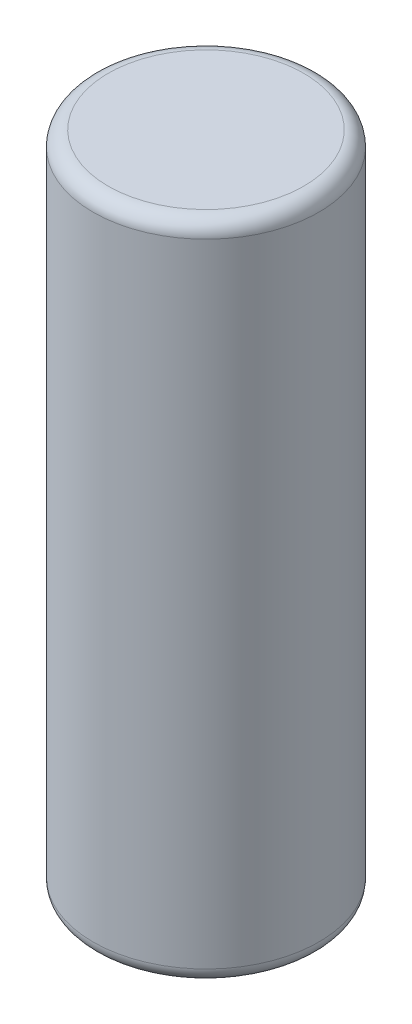
from build123d import *

# Parameters (mm, degrees)
SKETCH2_R           = 75
BOSS_EXTRUDE1_DEPTH = 440
FILLET1_R           = 10


with BuildPart() as part:
    # Sketch2 → Boss-Extrude1 (new body)
    with BuildSketch(Plane(origin=(0, 0, 0), x_dir=(1, 0, 0), z_dir=(0, 1, 0))):
        with Locations(Location((0, 0, 0), (0, 0, 270))):
            Circle(SKETCH2_R)
    extrude(amount=BOSS_EXTRUDE1_DEPTH)

    # Fillet1
    fillet1_edges = [part.edges().sort_by_distance(p)[0] for p in [
        (0, 0, -75),
        (0, 440, -75),
    ]]
    fillet(fillet1_edges, radius=FILLET1_R)


solid = part.part
